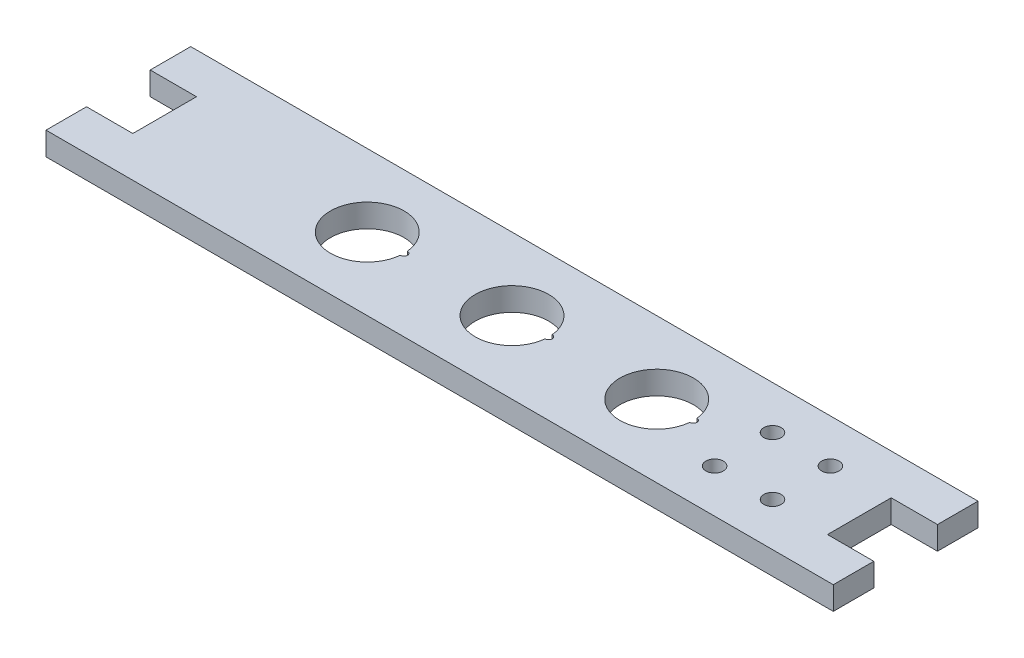
from build123d import *

# Parameters (mm, degrees)
SKETCH1_W           = 120
SKETCH1_H           = 25
SKETCH1_R           = 1.5
BOSS_EXTRUDE1_DEPTH = 4
SKETCH2_W           = 7
SKETCH2_H           = 4
BOSS_EXTRUDE2_DEPTH = 8


with BuildPart() as part:
    # Sketch1 → Boss-Extrude1 (new body)
    with BuildSketch(Plane(origin=(0, 0, 0), x_dir=(1, 0, 0), z_dir=(0, 1, 0))):
        Rectangle(SKETCH1_W, SKETCH1_H)
        with Locations(Location((40, 5, 0), (0, 0, 270))):
            Circle(SKETCH1_R, mode=Mode.SUBTRACT)
        with Locations(Location((40, -5, 0), (0, 0, 90))):
            Circle(SKETCH1_R, mode=Mode.SUBTRACT)
        with Locations(Location((50, 5, 0), (0, 0, 270))):
            Circle(SKETCH1_R, mode=Mode.SUBTRACT)
        with Locations(Location((50, -5, 0), (0, 0, 90))):
            Circle(SKETCH1_R, mode=Mode.SUBTRACT)
        with BuildLine():
            ThreePointArc((31.321653543, 0.599330025), (31.95, 0), (31.321653543, -0.599330025))
            ThreePointArc((31.321653543, -0.599330025), (18.65, 0), (31.321653543, 0.599330025))
        make_face(mode=Mode.SUBTRACT)
        with BuildLine():
            ThreePointArc((6.321653543, 0.599330025), (6.95, 0), (6.321653543, -0.599330025))
            ThreePointArc((6.321653543, -0.599330025), (-6.35, 0), (6.321653543, 0.599330025))
        make_face(mode=Mode.SUBTRACT)
        with BuildLine():
            ThreePointArc((-18.678346457, 0.599330025), (-18.05, 0), (-18.678346457, -0.599330025))
            ThreePointArc((-18.678346457, -0.599330025), (-31.35, 0), (-18.678346457, 0.599330025))
        make_face(mode=Mode.SUBTRACT)
    extrude(amount=BOSS_EXTRUDE1_DEPTH)

    # Sketch2 → Boss-Extrude2 (add)
    with BuildSketch(Plane.ZY.offset(60)):
        with Locations((-9, 2)):
            Rectangle(SKETCH2_W, SKETCH2_H)
        with Locations((9, 2)):
            Rectangle(SKETCH2_W, SKETCH2_H)
    boss_extrude2 = extrude(amount=BOSS_EXTRUDE2_DEPTH)

    # Mirror1: Boss-Extrude2 across plane
    add(boss_extrude2.mirror(Plane.ZY))


solid = part.part
